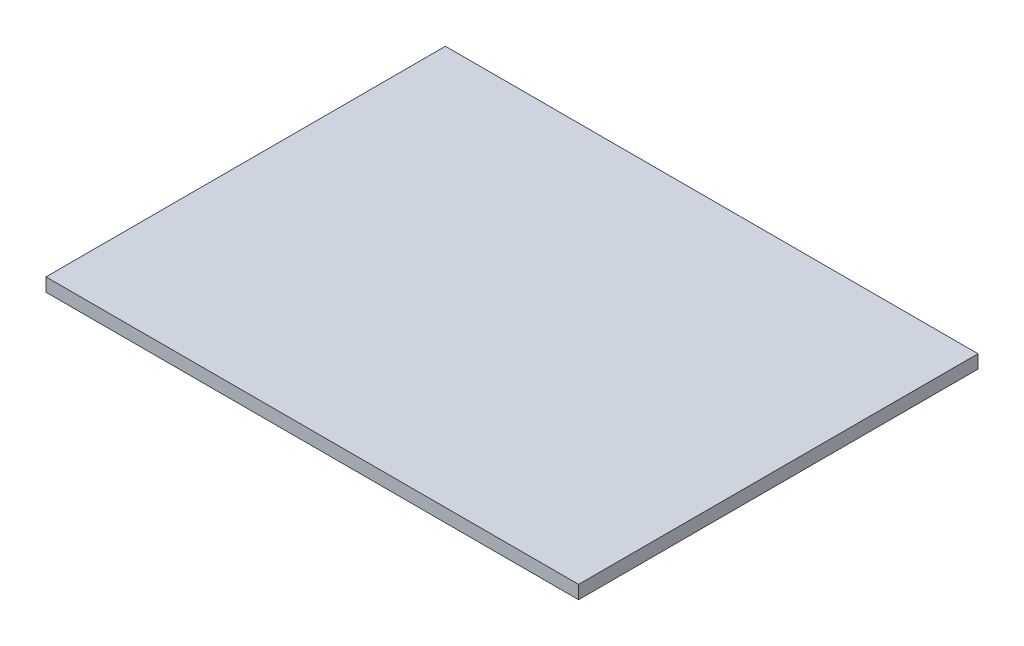
from build123d import *

# Parameters (mm, degrees)
SKETCH1_W           = 508
SKETCH1_H           = 381
BOSS_EXTRUDE1_DEPTH = 12.7


with BuildPart() as part:
    # Sketch1 → Boss-Extrude1 (new body)
    with BuildSketch(Plane(origin=(0, 0, 0), x_dir=(1, 0, 0), z_dir=(0, 1, 0))):
        Rectangle(SKETCH1_W, SKETCH1_H)
    extrude(amount=BOSS_EXTRUDE1_DEPTH)


solid = part.part
